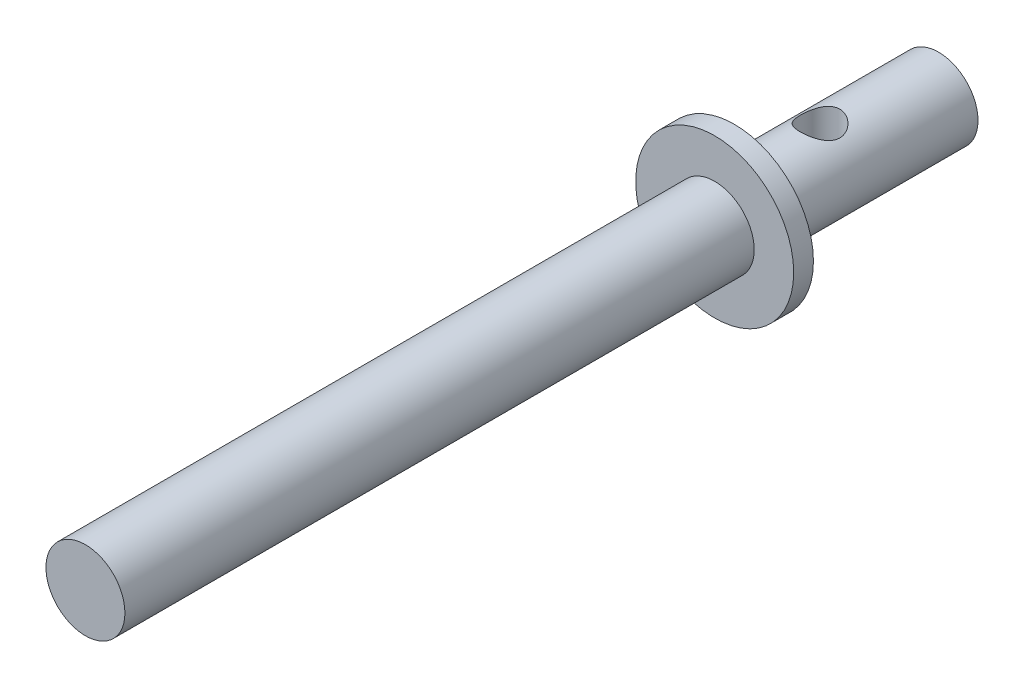
from build123d import *

# Parameters (mm, degrees)
SKETCH_1_R          = 3
EXTRUDE_1_DEPTH     = 64.8
SKETCH_2_R          = 6
EXTRUDE_2_DEPTH     = 1.5
SKETCH_10_R         = 1.5
CUT_EXTRUDE_1_DEPTH = 10


with BuildPart() as part:
    # 草图1 → 凸台-拉伸1 (new body)
    with BuildSketch(Plane.XY):
        Circle(SKETCH_1_R)
    extrude(amount=EXTRUDE_1_DEPTH)

    # 草图2 → 凸台-拉伸2 (add)
    with BuildSketch(Plane.XY.offset(17)):
        Circle(SKETCH_2_R)
    extrude(amount=-EXTRUDE_2_DEPTH)

    # 草图10 → 切除-拉伸1 (cut)
    with BuildSketch(Plane(origin=(0, -6.329883945, 9), x_dir=(-1, 0, 0), z_dir=(0, -1, 0))):
        with Locations(Location((0, 0, 0), (0, 0, 90))):
            Circle(SKETCH_10_R)
    extrude(amount=-CUT_EXTRUDE_1_DEPTH, mode=Mode.SUBTRACT)


solid = part.part
